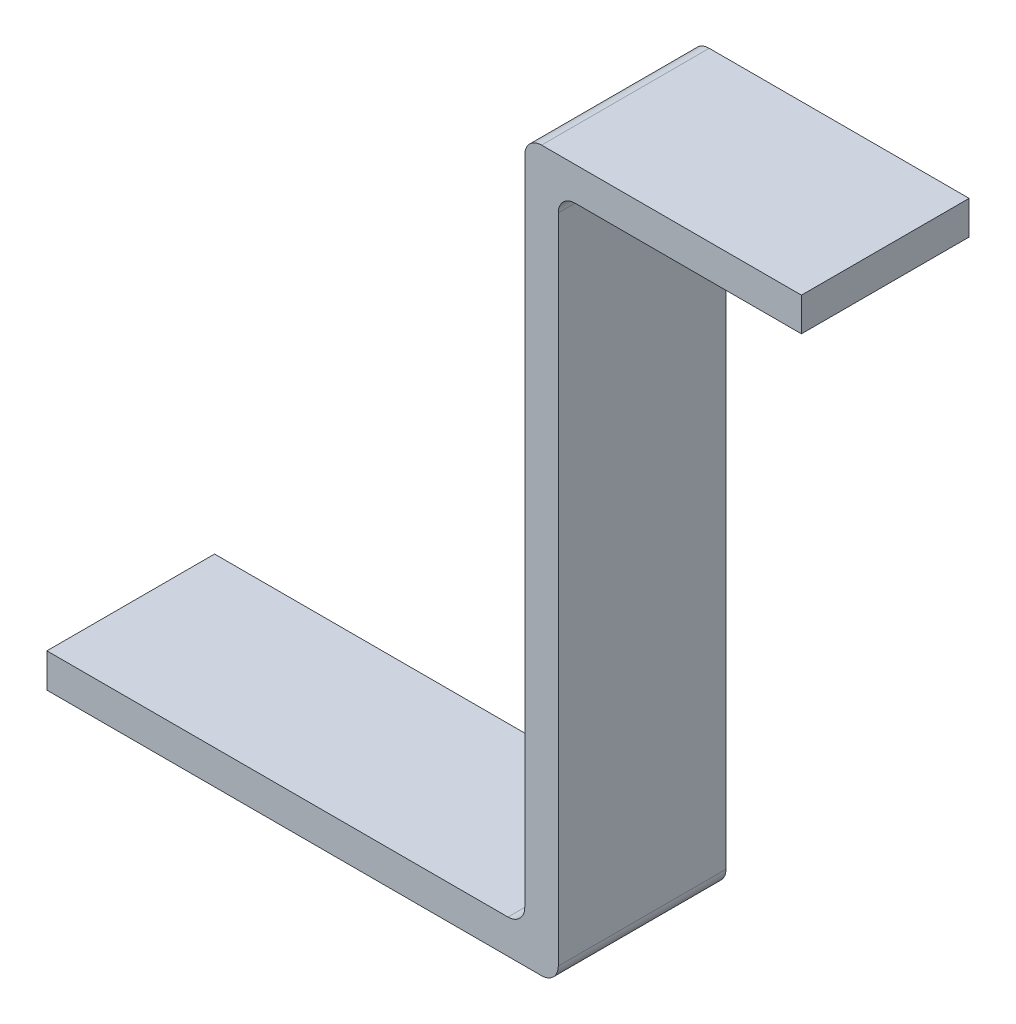
from build123d import *

# Parameters (mm, degrees)
SKETCH1_W           = 114.3
SKETCH1_H           = 152.4
BOSS_EXTRUDE1_DEPTH = 25.4
CUT_EXTRUDE1_DEPTH  = 99.578509321


with BuildPart() as part:
    # Sketch1 → Boss-Extrude1 (new body)
    with BuildSketch(Plane.XY):
        Rectangle(SKETCH1_W, SKETCH1_H)
    extrude(amount=BOSS_EXTRUDE1_DEPTH)

    # Sketch2 → Cut-Extrude1 (cut, through all)
    with BuildSketch(Plane.XY.offset(25.4)):
        with BuildLine():
            Line((57.15, 71.12), (22.86, 71.12))
            ThreePointArc((22.86, 71.12), (21.063948776, 70.376051224), (20.32, 68.58))
            Line((20.32, 68.58), (20.32, -30.226))
            ThreePointArc((20.32, -30.226), (19.576051224, -32.022051224), (17.78, -32.766))
            Line((17.78, -32.766), (-57.15, -32.766))
            Line((-57.15, -32.766), (-57.15, -76.2))
            Line((-57.15, -76.2), (57.15, -76.2))
            Line((57.15, -76.2), (57.15, 71.12))
        make_face()
        with BuildLine():
            ThreePointArc((15.24, 73.66), (15.983948776, 75.456051224), (17.78, 76.2))
            Line((17.78, 76.2), (-57.15, 76.2))
            Line((-57.15, 76.2), (-57.15, -27.6098))
            Line((-57.15, -27.6098), (12.7, -27.6098))
            ThreePointArc((12.7, -27.6098), (14.496051224, -26.865851224), (15.24, -25.0698))
            Line((15.24, -25.0698), (15.24, 73.66))
        make_face()
    extrude(amount=-CUT_EXTRUDE1_DEPTH, mode=Mode.SUBTRACT)


solid = part.part
